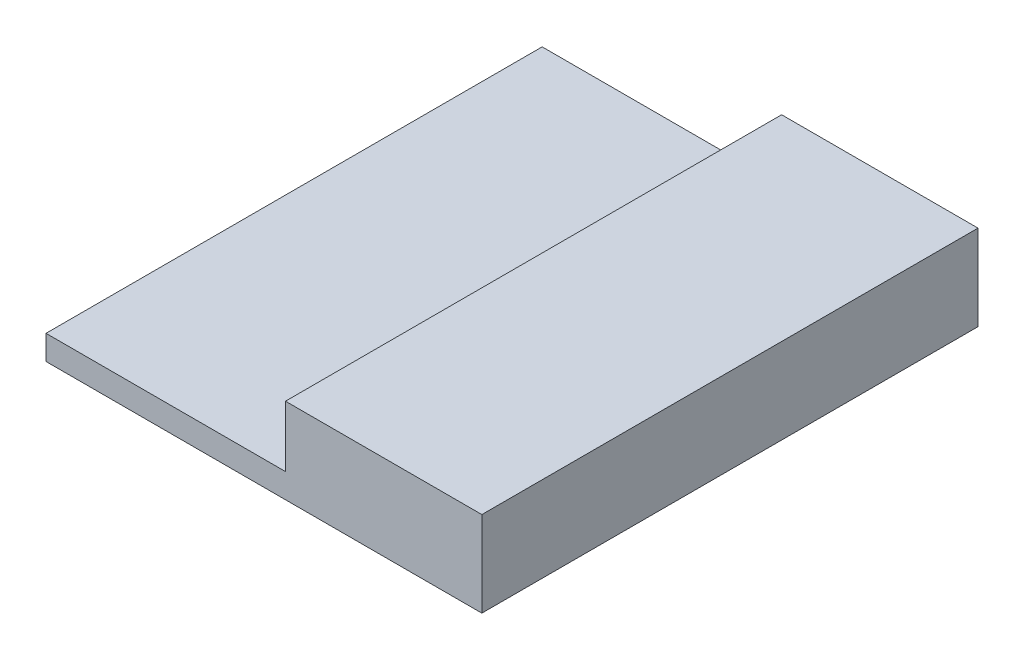
from build123d import *

# Parameters (mm, degrees)
SKETCH1_W           = 94.294111711
SKETCH1_H           = 123.247490411
BOSS_EXTRUDE1_DEPTH = 41
SKETCH2_W           = 123.247490411
SKETCH2_H           = 11.729493647
BOSS_EXTRUDE2_DEPTH = 115
SKETCH3_W           = 115
SKETCH3_H           = 11.729493647
BOSS_EXTRUDE3_DEPTH = 115


with BuildPart() as part:
    # Sketch1 → Boss-Extrude1 (new body)
    with BuildSketch(Plane(origin=(0, 0, 0), x_dir=(1, 0, 0), z_dir=(0, 1, 0))):
        with Locations((47.147055855, 61.623745206)):
            Rectangle(SKETCH1_W, SKETCH1_H)
    extrude(amount=BOSS_EXTRUDE1_DEPTH)

    # Sketch2 → Boss-Extrude2 (add)
    with BuildSketch(Plane.ZY):
        with Locations((-61.623745206, 5.864746823)):
            Rectangle(SKETCH2_W, SKETCH2_H)
    extrude(amount=BOSS_EXTRUDE2_DEPTH)

    # Sketch3 → Boss-Extrude3 (add)
    with BuildSketch(Plane(origin=(0, 0, -123.247490411), x_dir=(-1, 0, 0), z_dir=(0, 0, -1))):
        Polygon((-94.294111711, 41), (-94.294111711, 0), (0, 0), (0, 11.729493647), (0, 41), align=None)
        with Locations((57.5, 5.864746823)):
            Rectangle(SKETCH3_W, SKETCH3_H)
    extrude(amount=BOSS_EXTRUDE3_DEPTH)


solid = part.part
